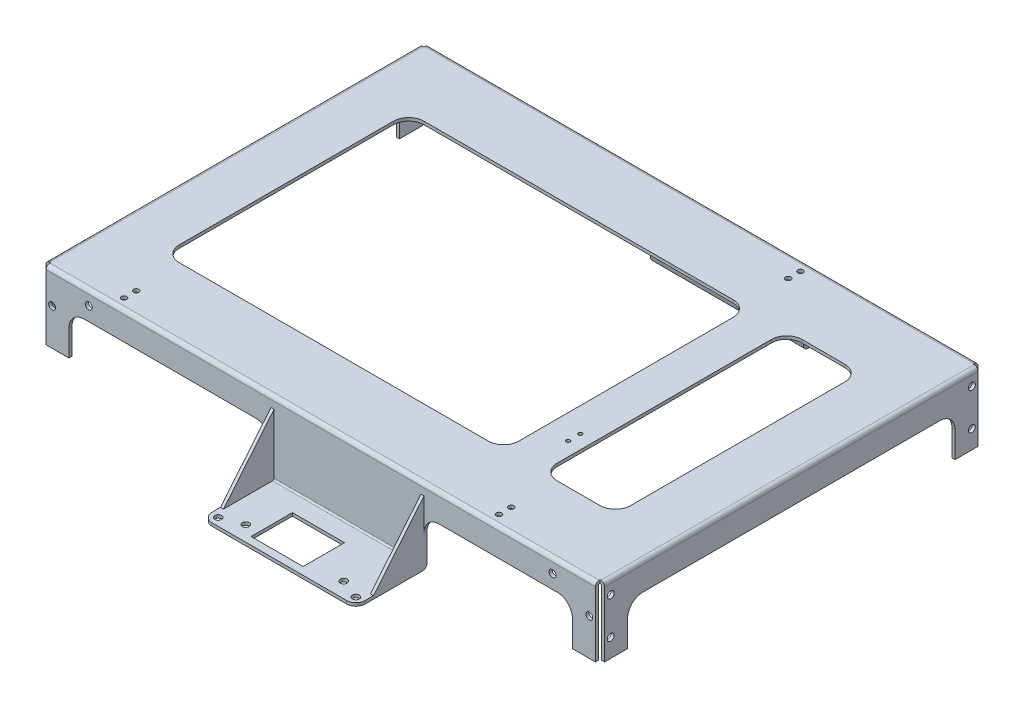
from build123d import *

# Parameters (mm, degrees)
BOSS_EXTRUDE1_DEPTH = 182.5
CUT_EXTRUDE1_DEPTH  = 313.779874672
BOSS_EXTRUDE2_START = 17.5
BOSS_EXTRUDE2_DEPTH = 50
BOSS_EXTRUDE3_DEPTH = 2
SKETCH5_R           = 11.25
SKETCH5_R_2         = 2.25
SKETCH5_W           = 34
SKETCH5_H           = 27
CUT_EXTRUDE2_DEPTH  = 2
FILLET1_R           = 10
SKETCH7_W           = 2
SKETCH7_H           = 246
BOSS_EXTRUDE4_DEPTH = 43
SKETCH8_W           = 3
SKETCH8_H           = 3
CUT_EXTRUDE4_DEPTH  = 254.103733675
FILLET2_R           = 0.5
FILLET3_R           = 2.5
CUT_EXTRUDE5_DEPTH  = 406.408744356
SKETCH10_R          = 2.25
CUT_EXTRUDE6_DEPTH  = 350.910702894
SKETCH11_R          = 2.25
CUT_EXTRUDE7_DEPTH  = 406.408744356
CUT_EXTRUDE8_DEPTH  = 254.466960372
SKETCH14_R          = 3.5
SKETCH14_R_2        = 8
CUT_EXTRUDE9_DEPTH  = 10
FILLET4_R           = 6
SKETCH15_R          = 1.75
SKETCH15_R_2        = 1.25
CUT_EXTRUDE10_DEPTH = 10


with BuildPart() as part:
    # Sketch1 → Boss-Extrude1 (new, symmetric)
    with BuildSketch(Plane(origin=(0, 0, 0), x_dir=(0, 0, -1), z_dir=(1, 0, 0))):
        with BuildLine():
            Line((123, -45), (125, -45))
            Line((125, -45), (125, -2.5))
            ThreePointArc((125, -2.5), (124.267766953, -0.732233047), (122.5, 0))
            Line((122.5, 0), (-122.5, 0))
            ThreePointArc((-122.5, 0), (-124.267766953, -0.732233047), (-125, -2.5))
            Line((-125, -2.5), (-125, -45))
            Line((-125, -45), (-123, -45))
            Line((-123, -45), (-123, -2.5))
            ThreePointArc((-123, -2.5), (-122.853553391, -2.146446609), (-122.5, -2))
            Line((-122.5, -2), (122.5, -2))
            ThreePointArc((122.5, -2), (122.853553391, -2.146446609), (123, -2.5))
            Line((123, -2.5), (123, -45))
        make_face()
    extrude(amount=BOSS_EXTRUDE1_DEPTH, both=True)

    # Sketch2 → Cut-Extrude1 (cut, through all)
    with BuildSketch(Plane(origin=(0, 0, -125), x_dir=(-1, 0, 0), z_dir=(0, 0, -1))):
        with BuildLine():
            Line((-164.5, -45), (164.5, -45))
            Line((164.5, -45), (164.5, -28))
            ThreePointArc((164.5, -28), (161.571067812, -20.928932188), (154.5, -18))
            Line((154.5, -18), (-154.5, -18))
            ThreePointArc((-154.5, -18), (-161.571067812, -20.928932188), (-164.5, -28))
            Line((-164.5, -28), (-164.5, -45))
        make_face()
    extrude(amount=-CUT_EXTRUDE1_DEPTH, mode=Mode.SUBTRACT)

    # Sketch3 → Boss-Extrude2 (add, symmetric)
    with BuildSketch(Plane(origin=(0, 0, 0), x_dir=(0, 0, -1), z_dir=(1, 0, 0)).offset(BOSS_EXTRUDE2_START)):
        with BuildLine():
            Line((-169.5, -47), (-126, -47))
            ThreePointArc((-126, -47), (-125.292893219, -46.707106781), (-125, -46))
            Line((-125, -46), (-125, -18))
            Line((-125, -18), (-123, -18))
            Line((-123, -18), (-123, -46))
            ThreePointArc((-123, -46), (-123.878679656, -48.121320344), (-126, -49))
            Line((-126, -49), (-169.5, -49))
            Line((-169.5, -49), (-169.5, -47))
        make_face()
        with BuildLine():
            Line((126, -47), (169.5, -47))
            Line((169.5, -47), (169.5, -49))
            Line((169.5, -49), (126, -49))
            ThreePointArc((126, -49), (123.878679656, -48.121320344), (123, -46))
            Line((123, -46), (123, -18))
            Line((123, -18), (125, -18))
            Line((125, -18), (125, -46))
            ThreePointArc((125, -46), (125.292893219, -46.707106781), (126, -47))
        make_face()
    extrude(amount=BOSS_EXTRUDE2_DEPTH, both=True)

    # Sketch4 → Boss-Extrude3 (add)
    with BuildSketch(Plane.ZY.offset(32.5)):
        Polygon((125, -7), (158, -47), (125, -47), align=None)
        Polygon((-125, -7), (-158, -47), (-125, -47), align=None)
    boss_extrude3 = extrude(amount=-BOSS_EXTRUDE3_DEPTH)

    # Mirror1: Boss-Extrude3 across plane
    add(boss_extrude3.mirror(Plane(origin=(17.5, 0, 0), x_dir=(0, 0, 1), z_dir=(1, 0, 0))))

    # Sketch5 → Cut-Extrude2 (cut)
    with BuildSketch(Plane.XZ.offset(49)):
        with Locations(Location((17.5, -148.5, 0), (0, 0, 270))):
            Circle(SKETCH5_R)
        with Locations(Location((2, -133, 0), (0, 0, 270))):
            Circle(SKETCH5_R_2)
        with Locations(Location((2, -164, 0), (0, 0, 270))):
            Circle(SKETCH5_R_2)
        with Locations(Location((33, -164, 0), (0, 0, 270))):
            Circle(SKETCH5_R_2)
        with Locations(Location((33, -133, 0), (0, 0, 270))):
            Circle(SKETCH5_R_2)
        with Locations(Location((-27.5, -164.5, 0), (0, 0, 270))):
            Circle(SKETCH5_R_2)
        with Locations(Location((-14.5, -141.85, 0), (0, 0, 270))):
            Circle(SKETCH5_R_2)
        with Locations(Location((49.5, -141.85, 0), (0, 0, 270))):
            Circle(SKETCH5_R_2)
        with Locations(Location((-27.5, 164.5, 0), (0, 0, 270))):
            Circle(SKETCH5_R_2)
        with Locations(Location((-14.5, 159.5, 0), (0, 0, 270))):
            Circle(SKETCH5_R_2)
        with Locations(Location((49.5, 159.5, 0), (0, 0, 270))):
            Circle(SKETCH5_R_2)
        with Locations(Location((62.5, -164.5, 0), (0, 0, 270))):
            Circle(SKETCH5_R_2)
        with Locations(Location((62.5, 164.5, 0), (0, 0, 270))):
            Circle(SKETCH5_R_2)
        with Locations((11, 151)):
            Rectangle(SKETCH5_W, SKETCH5_H)
    extrude(amount=-CUT_EXTRUDE2_DEPTH, mode=Mode.SUBTRACT)

    # Fillet1
    fillet1_edges = [part.edges().sort_by_distance(p)[0] for p in [
        (-32.5, -18, 124),
        (67.5, -18, 124),
        (-32.5, -18, -124),
        (67.5, -18, -124),
    ]]
    fillet(fillet1_edges, radius=FILLET1_R)

    # Sketch7 → Boss-Extrude4 (add)
    with BuildSketch(Plane.XZ.offset(2)):
        with Locations((-181.5, 0)):
            Rectangle(SKETCH7_W, SKETCH7_H)
        with Locations((181.5, 0)):
            Rectangle(SKETCH7_W, SKETCH7_H)
    extrude(amount=BOSS_EXTRUDE4_DEPTH)

    # Sketch8 → Cut-Extrude4 (cut, through all)
    with BuildSketch(Plane.XZ.offset(45)):
        with Locations((-181, 123.5)):
            Rectangle(SKETCH8_W, SKETCH8_H)
        with Locations((-181, -123.5)):
            Rectangle(SKETCH8_W, SKETCH8_H)
        with Locations((181, -123.5)):
            Rectangle(SKETCH8_W, SKETCH8_H)
        with Locations((181, 123.5)):
            Rectangle(SKETCH8_W, SKETCH8_H)
    extrude(amount=-CUT_EXTRUDE4_DEPTH, mode=Mode.SUBTRACT)

    # Fillet2
    fillet2_edges = [part.edges().sort_by_distance(p)[0] for p in [
        (-180.5, -2, 0),
        (180.5, -2, 0),
    ]]
    fillet(fillet2_edges, radius=FILLET2_R)

    # Fillet3
    fillet3_edges = [part.edges().sort_by_distance(p)[0] for p in [
        (-182.5, 0, 0),
        (182.5, 0, 0),
    ]]
    fillet(fillet3_edges, radius=FILLET3_R)

    # Sketch9 → Cut-Extrude5 (cut, through all)
    with BuildSketch(Plane.ZY.offset(182.5)):
        with BuildLine():
            Line((-107, -45), (107, -45))
            Line((107, -45), (107, -28))
            ThreePointArc((107, -28), (104.071067812, -20.928932188), (97, -18))
            Line((97, -18), (-97, -18))
            ThreePointArc((-97, -18), (-104.071067812, -20.928932188), (-107, -28))
            Line((-107, -28), (-107, -45))
        make_face()
    extrude(amount=-CUT_EXTRUDE5_DEPTH, mode=Mode.SUBTRACT)

    # Sketch10 → Cut-Extrude6 (cut, through all)
    with BuildSketch(Plane.XY.offset(125)):
        with Locations((-175.5, -21)):
            Circle(SKETCH10_R)
        with Locations((-151.5, -9)):
            Circle(SKETCH10_R)
        with Locations((151.5, -9)):
            Circle(SKETCH10_R)
        with Locations((175.5, -21)):
            Circle(SKETCH10_R)
    extrude(amount=-CUT_EXTRUDE6_DEPTH, mode=Mode.SUBTRACT)

    # Sketch11 → Cut-Extrude7 (cut, through all)
    with BuildSketch(Plane.ZY.offset(182.5)):
        with Locations((-118, -9)):
            Circle(SKETCH11_R)
        with Locations((-118, -33)):
            Circle(SKETCH11_R)
        with Locations((118, -9)):
            Circle(SKETCH11_R)
        with Locations((118, -33)):
            Circle(SKETCH11_R)
    extrude(amount=-CUT_EXTRUDE7_DEPTH, mode=Mode.SUBTRACT)

    # Sketch12 → Cut-Extrude8 (cut, through all)
    with BuildSketch(Plane.XZ.offset(2)):
        with BuildLine():
            Line((109.5, 80), (137.5, 80))
            ThreePointArc((137.5, 80), (144.571067812, 77.071067812), (147.5, 70))
            Line((147.5, 70), (147.5, -70))
            ThreePointArc((147.5, -70), (144.571067812, -77.071067812), (137.5, -80))
            Line((137.5, -80), (109.5, -80))
            ThreePointArc((109.5, -80), (102.428932188, -77.071067812), (99.5, -70))
            Line((99.5, -70), (99.5, 70))
            ThreePointArc((99.5, 70), (102.428932188, 77.071067812), (109.5, 80))
        make_face()
        with BuildLine():
            Line((-137.5, 80), (64.5, 80))
            ThreePointArc((64.5, 80), (71.571067812, 77.071067812), (74.5, 70))
            Line((74.5, 70), (74.5, -70))
            ThreePointArc((74.5, -70), (71.571067812, -77.071067812), (64.5, -80))
            Line((64.5, -80), (-137.5, -80))
            ThreePointArc((-137.5, -80), (-144.571067812, -77.071067812), (-147.5, -70))
            Line((-147.5, -70), (-147.5, 70))
            ThreePointArc((-147.5, 70), (-144.571067812, 77.071067812), (-137.5, 80))
        make_face()
    extrude(amount=-CUT_EXTRUDE8_DEPTH, mode=Mode.SUBTRACT)

    # Sketch14 → Cut-Extrude9 (cut)
    with BuildSketch(Plane(origin=(0, 0, -125), x_dir=(-1, 0, 0), z_dir=(0, 0, -1))):
        with Locations((-112.5, -10)):
            Circle(SKETCH14_R)
        with Locations((112.5, -10)):
            Circle(SKETCH14_R)
        with Locations((-51.5, -11)):
            Circle(SKETCH14_R_2)
    extrude(amount=-CUT_EXTRUDE9_DEPTH, mode=Mode.SUBTRACT)

    # Fillet4
    fillet4_edges = [part.edges().sort_by_distance(p)[0] for p in [
        (-32.5, -48, 169.5),
        (67.5, -48, 169.5),
        (-32.5, -48, -169.5),
        (67.5, -48, -169.5),
    ]]
    fillet(fillet4_edges, radius=FILLET4_R)

    # Sketch15 → Cut-Extrude10 (cut)
    with BuildSketch(Plane(origin=(0, 0, 0), x_dir=(1, 0, 0), z_dir=(0, 1, 0))):
        with Locations(Location((109.5, -118, 0), (0, 0, 270))):
            Circle(SKETCH15_R)
        with Locations(Location((109.5, -110, 0), (0, 0, 270))):
            Circle(SKETCH15_R)
        with Locations(Location((-135.5, -118, 0), (0, 0, 270))):
            Circle(SKETCH15_R)
        with Locations(Location((-135.5, -110, 0), (0, 0, 270))):
            Circle(SKETCH15_R)
        with Locations(Location((70.5, 110, 0), (0, 0, 270))):
            Circle(SKETCH15_R)
        with Locations(Location((70.5, 118, 0), (0, 0, 270))):
            Circle(SKETCH15_R)
        with Locations(Location((90.5, -53.8, 0), (0, 0, 270))):
            Circle(SKETCH15_R_2)
        with Locations(Location((90.5, -45.8, 0), (0, 0, 270))):
            Circle(SKETCH15_R_2)
    extrude(amount=-CUT_EXTRUDE10_DEPTH, mode=Mode.SUBTRACT)


solid = part.part
